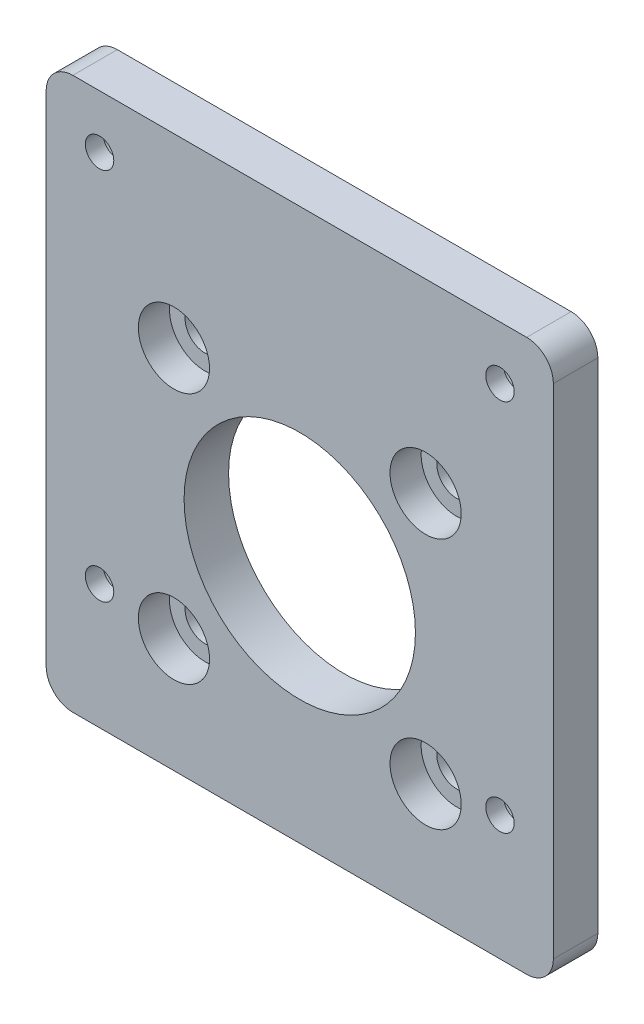
from build123d import *

# Parameters (mm, degrees)
SKETCH1_R           = 2.25
SKETCH1_R_2         = 13
SKETCH1_R_3         = 1.6
BOSS_EXTRUDE1_DEPTH = 5
SKETCH1_5_R         = 3
SKETCH1_5_R_2       = 1.6
CUT_EXTRUDE1_DEPTH  = 3
SKETCH2_R           = 4
CUT_EXTRUDE2_DEPTH  = 3.5


with BuildPart() as part:
    # Sketch1 → Boss-Extrude1 (new body)
    with BuildSketch(Plane.XY):
        with BuildLine():
            Line((-141.025912834, 67.472903007), (-192.025912834, 67.472903007))
            ThreePointArc((-192.025912834, 67.472903007), (-194.147233178, 66.59422335), (-195.025912834, 64.472903007))
            Line((-195.025912834, 64.472903007), (-195.025912834, 8.472903007))
            ThreePointArc((-195.025912834, 8.472903007), (-194.147233178, 6.351582663), (-192.025912834, 5.472903007))
            Line((-192.025912834, 5.472903007), (-141.025912834, 5.472903007))
            ThreePointArc((-141.025912834, 5.472903007), (-138.90459249, 6.351582663), (-138.025912834, 8.472903007))
            Line((-138.025912834, 8.472903007), (-138.025912834, 64.472903007))
            ThreePointArc((-138.025912834, 64.472903007), (-138.90459249, 66.59422335), (-141.025912834, 67.472903007))
        make_face()
        with Locations((-180.668048458, 18.330767383)):
            Circle(SKETCH1_R, mode=Mode.SUBTRACT)
        with Locations((-152.38377721, 18.330767383)):
            Circle(SKETCH1_R, mode=Mode.SUBTRACT)
        with Locations((-166.525912834, 32.472903007)):
            Circle(SKETCH1_R_2, mode=Mode.SUBTRACT)
        with Locations((-180.668048458, 46.61503863)):
            Circle(SKETCH1_R, mode=Mode.SUBTRACT)
        with Locations((-152.38377721, 46.61503863)):
            Circle(SKETCH1_R, mode=Mode.SUBTRACT)
        with Locations((-189.025912834, 19.472903007)):
            Circle(SKETCH1_R_3, mode=Mode.SUBTRACT)
        with Locations((-144.025912834, 19.472903007)):
            Circle(SKETCH1_R_3, mode=Mode.SUBTRACT)
        with Locations((-189.025912834, 61.472903007)):
            Circle(SKETCH1_R_3, mode=Mode.SUBTRACT)
        with Locations((-144.025912834, 61.472903007)):
            Circle(SKETCH1_R_3, mode=Mode.SUBTRACT)
    extrude(amount=BOSS_EXTRUDE1_DEPTH)

    # Sketch1<5> → Cut-Extrude1 (cut)
    # profile 1 of 4: a face of its own
    with BuildSketch(Plane.XY):
        with Locations((-144.025912834, 61.472903007)):
            Circle(SKETCH1_5_R)
        with Locations((-144.025912834, 61.472903007)):
            Circle(SKETCH1_5_R_2, mode=Mode.SUBTRACT)
    # profile 2 of 4: a face of its own
    with BuildSketch(Plane.XY):
        with Locations((-189.025912834, 61.472903007)):
            Circle(SKETCH1_5_R)
        with Locations((-189.025912834, 61.472903007)):
            Circle(SKETCH1_5_R_2, mode=Mode.SUBTRACT)
    # profile 3 of 4: a face of its own
    with BuildSketch(Plane.XY):
        with Locations((-189.025912834, 19.472903007)):
            Circle(SKETCH1_5_R)
    # profile 4 of 4: a face of its own
    with BuildSketch(Plane.XY):
        with Locations((-144.025912834, 19.472903007)):
            Circle(SKETCH1_5_R)
        with Locations((-144.025912834, 19.472903007)):
            Circle(SKETCH1_5_R_2, mode=Mode.SUBTRACT)
    extrude(amount=CUT_EXTRUDE1_DEPTH, mode=Mode.SUBTRACT)

    # Sketch2 → Cut-Extrude2 (cut)
    with BuildSketch(Plane.XY.offset(5)):
        with Locations((-180.668048458, 46.61503863)):
            Circle(SKETCH2_R)
        with Locations((-152.38377721, 46.61503863)):
            Circle(SKETCH2_R)
        with Locations((-152.38377721, 18.330767383)):
            Circle(SKETCH2_R)
        with Locations((-180.668048458, 18.330767383)):
            Circle(SKETCH2_R)
    extrude(amount=-CUT_EXTRUDE2_DEPTH, mode=Mode.SUBTRACT)


solid = part.part
